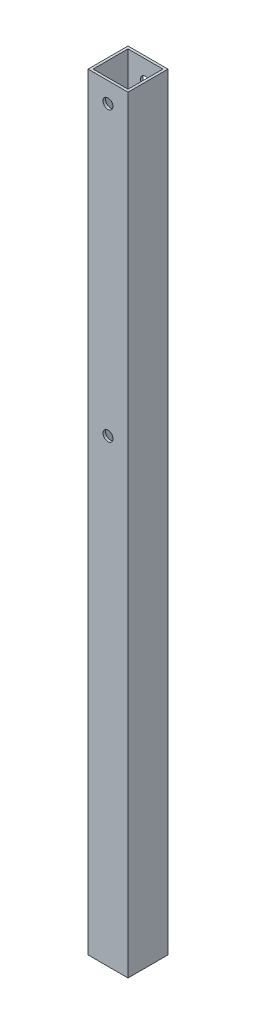
from build123d import *

# Parameters (mm, degrees)
SKETCH1_W                   = 25.4
SKETCH1_H                   = 25.4
SKETCH1_W_2                 = 22.225
SKETCH1_H_2                 = 22.225
BOSS_EXTRUDE1_DEPTH         = 487.68
F_1_4_0_25_DIAMETER_HOLE1_D = 6.35


with BuildPart() as part:
    # Sketch1 → Boss-Extrude1 (new body)
    with BuildSketch(Plane(origin=(0, 0, 0), x_dir=(1, 0, 0), z_dir=(0, 1, 0))):
        Rectangle(SKETCH1_W, SKETCH1_H)
        Rectangle(SKETCH1_W_2, SKETCH1_H_2, mode=Mode.SUBTRACT)
    extrude(amount=BOSS_EXTRUDE1_DEPTH)

    # 1/4 (0.25) Diameter Hole1 (through all)
    with Locations(Plane.XY.offset(12.7)):
        with Locations((0, 474.98), (0, 292.1)):
            Hole(F_1_4_0_25_DIAMETER_HOLE1_D / 2)


solid = part.part
